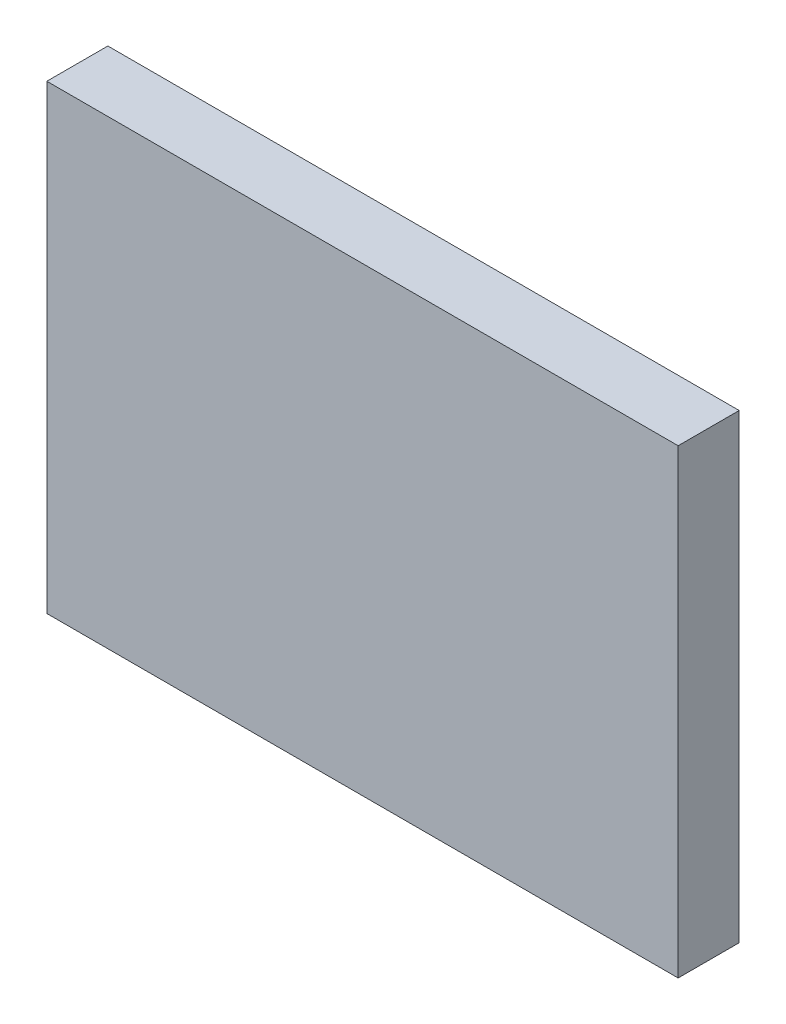
from build123d import *

# Parameters (mm, degrees)
SKETCH1_W           = 103.440607376
SKETCH1_H           = 75.528062529
BOSS_EXTRUDE1_DEPTH = 10


with BuildPart() as part:
    # Sketch1 → Boss-Extrude1 (new body)
    with BuildSketch(Plane.XY):
        with Locations((8.118354547, 1.824349337)):
            Rectangle(SKETCH1_W, SKETCH1_H)
    extrude(amount=BOSS_EXTRUDE1_DEPTH)


solid = part.part
